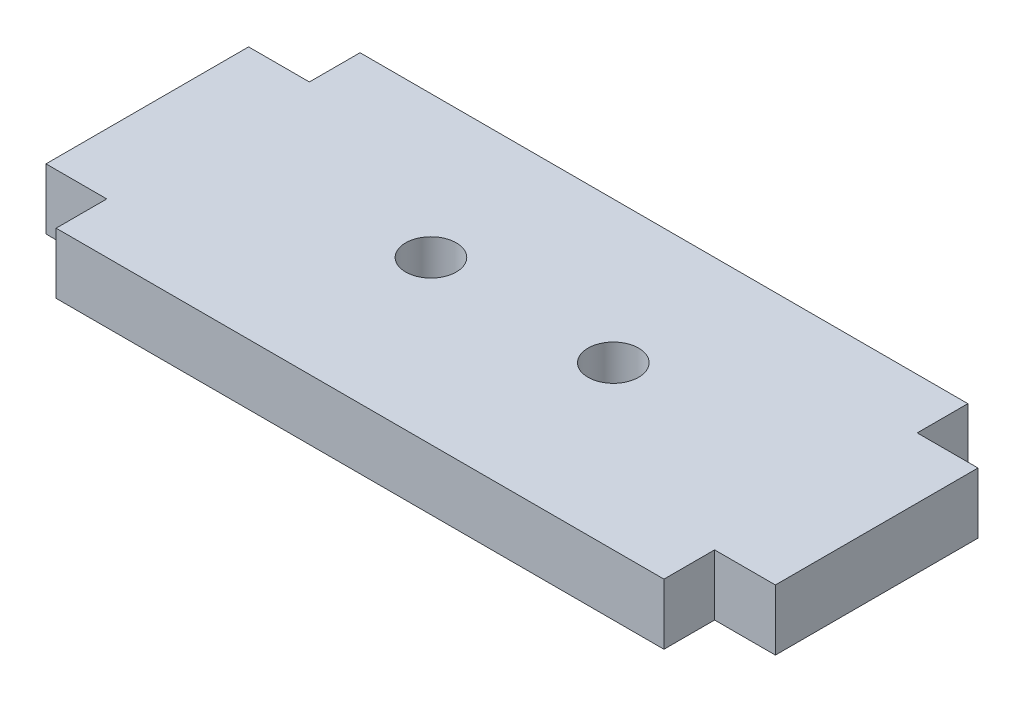
from build123d import *

# Parameters (mm, degrees)
SKETCH1_R           = 1.25
BOSS_EXTRUDE1_DEPTH = 3


with BuildPart() as part:
    # Sketch1 → Boss-Extrude1 (new body)
    with BuildSketch(Plane(origin=(0, 0, 0), x_dir=(1, 0, 0), z_dir=(0, 1, 0))):
        Polygon((0, 12.5), (0, 15), (30, 15), (30, 12.5), (33, 12.5), (33, 2.5), (30, 2.5), (30, 0), (0, 0), (0, 2.5), (-3, 2.5), (-3, 12.5), align=None)
        with Locations(Location((10.5, 8, 0), (0, 0, 270))):
            Circle(SKETCH1_R, mode=Mode.SUBTRACT)
        with Locations(Location((19.5, 8, 0), (0, 0, 270))):
            Circle(SKETCH1_R, mode=Mode.SUBTRACT)
    extrude(amount=BOSS_EXTRUDE1_DEPTH)


solid = part.part
